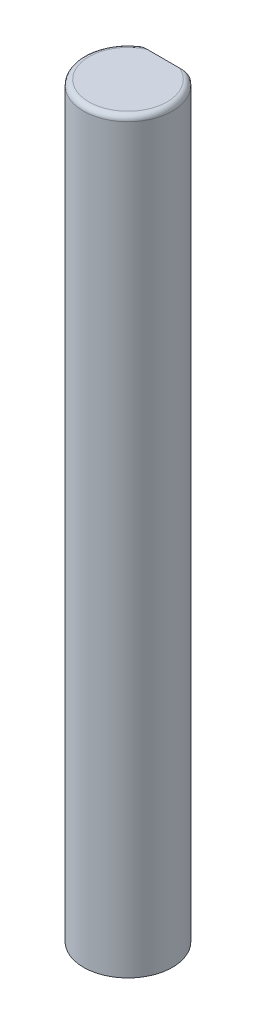
from build123d import *

# Parameters (mm, degrees)
SKETCH1_R           = 2.5
BOSS_EXTRUDE1_DEPTH = 42
SKETCH2_W           = 8.231649798
SKETCH2_H           = 2.477236303
CUT_EXTRUDE1_DEPTH  = 18
FILLET1_R           = 0.3


with BuildPart() as part:
    # Sketch1 → Boss-Extrude1 (new body)
    with BuildSketch(Plane(origin=(0, 0, 0), x_dir=(1, 0, 0), z_dir=(0, 1, 0))):
        with Locations(Location((0, 0, 0), (0, 0, 90))):
            Circle(SKETCH1_R)
    extrude(amount=BOSS_EXTRUDE1_DEPTH)

    # Sketch2 → Cut-Extrude1 (cut)
    with BuildSketch(Plane(origin=(0, 42, 0), x_dir=(1, 0, 0), z_dir=(0, 1, 0))):
        with Locations((-0.064511362, 3.238618152)):
            Rectangle(SKETCH2_W, SKETCH2_H)
    extrude(amount=-CUT_EXTRUDE1_DEPTH, mode=Mode.SUBTRACT)

    # Fillet1
    fillet1_edges = [part.edges().sort_by_distance(p)[0] for p in [
        (0, 42, 2.5),
    ]]
    fillet(fillet1_edges, radius=FILLET1_R)


solid = part.part
